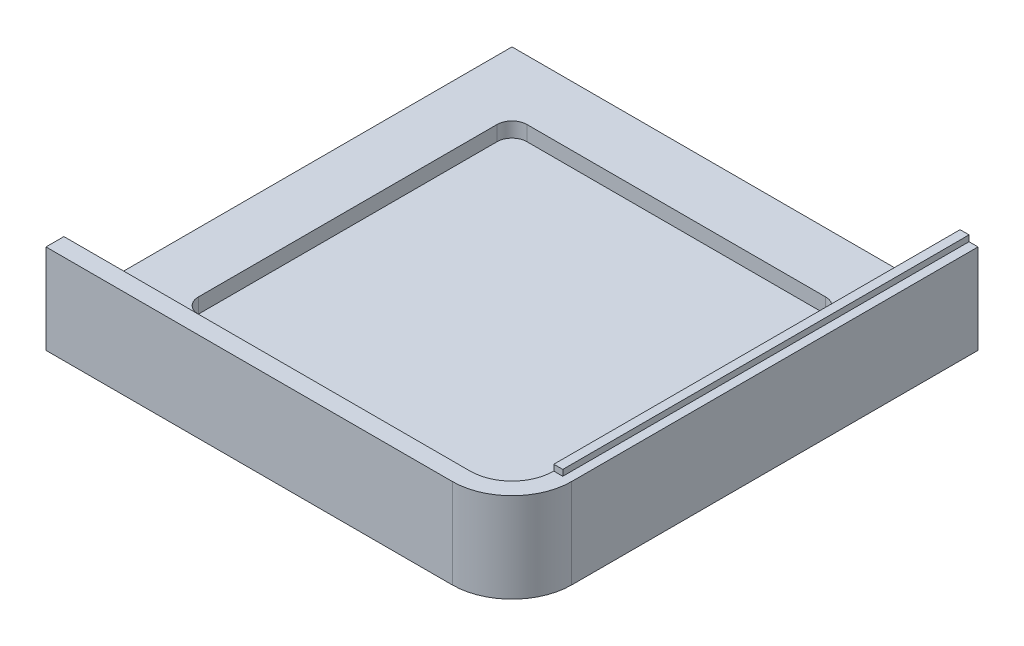
from build123d import *

# Parameters (mm, degrees)
SKIZZE9_W               = 156
SKIZZE9_H               = 156
SKIZZE9_W_2             = 110
SKIZZE9_H_2             = 110
LINEAR_AUSTRAGEN4_DEPTH = 5
VERRUNDUNG5_R           = 5
SKIZZE10_W              = 156
SKIZZE10_H              = 156
LINEAR_AUSTRAGEN5_DEPTH = 5
LINEAR_AUSTRAGEN6_DEPTH = 20
VERRUNDUNG6_R           = 20
VERRUNDUNG7_R           = 14
SKIZZE12_W              = 3
SKIZZE12_H              = 136
LINEAR_AUSTRAGEN7_DEPTH = 2


with BuildPart() as part:
    # Skizze9 → Linear austragen4 (new body)
    with BuildSketch(Plane(origin=(0, 0, 0), x_dir=(1, 0, 0), z_dir=(0, 1, 0))):
        with Locations((78, 78)):
            Rectangle(SKIZZE9_W, SKIZZE9_H)
        with Locations((75, 81)):
            Rectangle(SKIZZE9_W_2, SKIZZE9_H_2, mode=Mode.SUBTRACT)
    extrude(amount=LINEAR_AUSTRAGEN4_DEPTH)

    # Verrundung5
    verrundung5_edges = [part.edges().sort_by_distance(p)[0] for p in [
        (20, 2.5, -136),
        (20, 2.5, -26),
        (130, 2.5, -26),
        (130, 2.5, -136),
    ]]
    fillet(verrundung5_edges, radius=VERRUNDUNG5_R)

    # Skizze10 → Linear austragen5 (add)
    with BuildSketch(Plane.XZ):
        with Locations((78, -78)):
            Rectangle(SKIZZE10_W, SKIZZE10_H)
    extrude(amount=LINEAR_AUSTRAGEN5_DEPTH)

    # Skizze11 → Linear austragen6 (add)
    with BuildSketch(Plane(origin=(0, 5, 0), x_dir=(1, 0, 0), z_dir=(0, 1, 0))):
        Polygon((0, 0), (156, 0), (156, 156), (150, 156), (150, 6), (0, 6), align=None)
    extrude(amount=LINEAR_AUSTRAGEN6_DEPTH)

    # Verrundung6
    verrundung6_edges = [part.edges().sort_by_distance(p)[0] for p in [
        (156, 10, 0),
    ]]
    fillet(verrundung6_edges, radius=VERRUNDUNG6_R)

    # Verrundung7
    verrundung7_edges = [part.edges().sort_by_distance(p)[0] for p in [
        (150, 15, -6),
    ]]
    fillet(verrundung7_edges, radius=VERRUNDUNG7_R)

    # Skizze12 → Linear austragen7 (add)
    with BuildSketch(Plane(origin=(0, 25, 0), x_dir=(1, 0, 0), z_dir=(0, 1, 0))):
        with Locations((151.5, 88)):
            Rectangle(SKIZZE12_W, SKIZZE12_H)
    extrude(amount=LINEAR_AUSTRAGEN7_DEPTH)


solid = part.part
